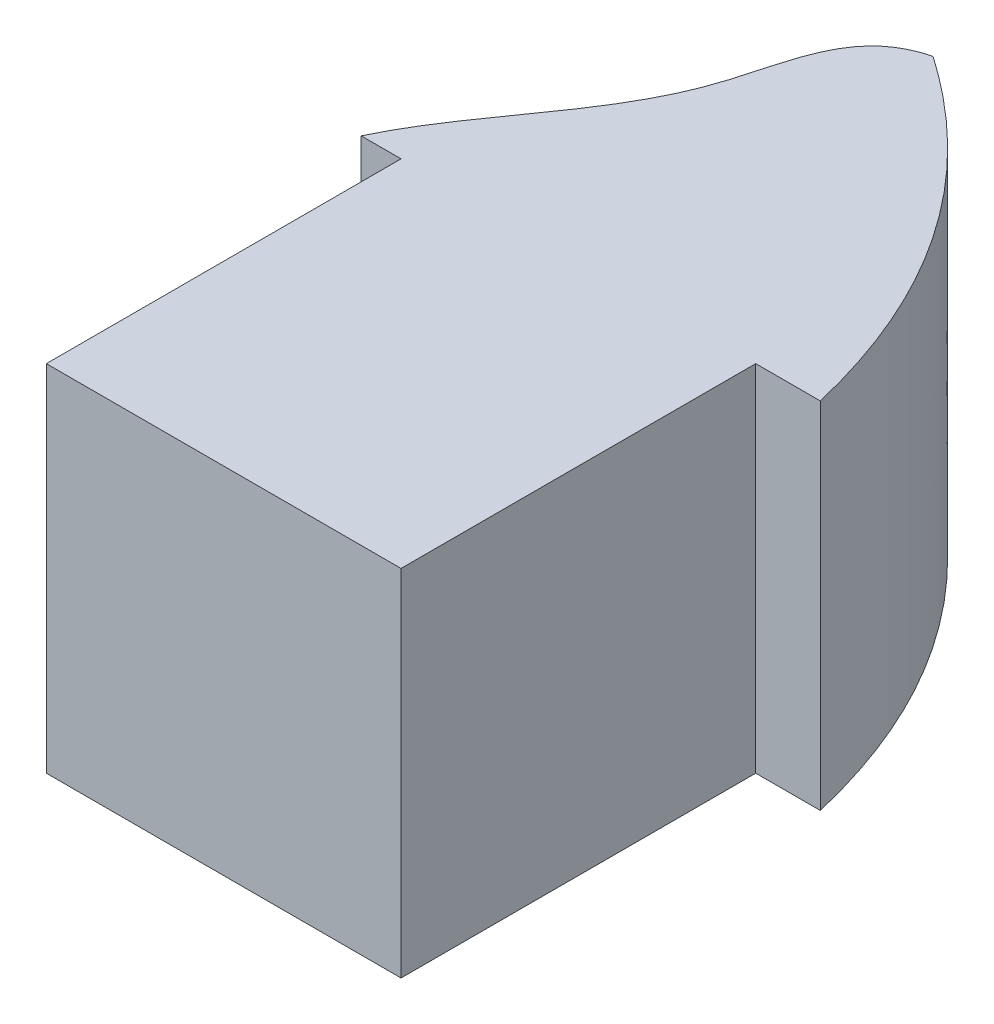
from build123d import *

# Parameters (mm, degrees)
SKETCH1_W           = 3.175
SKETCH1_H           = 3.175
BOSS_EXTRUDE1_DEPTH = 6.35
SKETCH2_W           = 6.35
SKETCH2_H           = 3.175
BOSS_EXTRUDE2_DEPTH = 3.175
CUT_EXTRUDE1_DEPTH  = 39.17066496


with BuildPart() as part:
    # Sketch1 → Boss-Extrude1 (new body)
    with BuildSketch(Plane.XY):
        with Locations((34.329620229, 7.041119721)):
            Rectangle(SKETCH1_W, SKETCH1_H)
    extrude(amount=-BOSS_EXTRUDE1_DEPTH)

    # Sketch2 → Boss-Extrude2 (add)
    with BuildSketch(Plane.XZ.offset(-5.453619721)):
        with Locations((34.329620229, -4.7625)):
            Rectangle(SKETCH2_W, SKETCH2_H)
    extrude(amount=-BOSS_EXTRUDE2_DEPTH)

    # Sketch3 → Cut-Extrude1 (cut, through all)
    with BuildSketch(Plane.XZ.offset(-5.453619721)):
        with BuildLine():
            Line((32.385431634, -3.175), (31.154620229, -3.175))
            Line((31.154620229, -3.175), (31.154620229, -6.35))
            Line((31.154620229, -6.35), (34.329620229, -6.35))
            add(Edge.make_bspline(
                [(32.385431634, -3.175), (32.718801205, -3.878392461), (33.690338088, -4.759412755), (33.756564545, -6.211143962), (34.329620229, -6.35)],
                knots=[0, 0, 0, 0, 0.611532208, 1, 1, 1, 1], degree=3))
        make_face()
        with BuildLine():
            add(Edge.make_bspline(
                [(36.495266727, -3.175), (36.021022313, -5.174773028), (34.329620229, -6.35)],
                knots=[0, 0, 0, 1, 1, 1], degree=2))
            Line((34.329620229, -6.35), (37.504620229, -6.35))
            Line((37.504620229, -6.35), (37.504620229, -3.175))
            Line((37.504620229, -3.175), (36.495266727, -3.175))
        make_face()
        Polygon((31.154620229, -3.175), (30.277564026, -3.175), (30.277564026, -6.620269694), (37.803879314, -6.620269694), (37.803879314, -3.175), (37.504620229, -3.175), (37.504620229, -6.35), (34.329620229, -6.35), (31.154620229, -6.35), align=None)
    extrude(amount=-CUT_EXTRUDE1_DEPTH, mode=Mode.SUBTRACT)


solid = part.part
